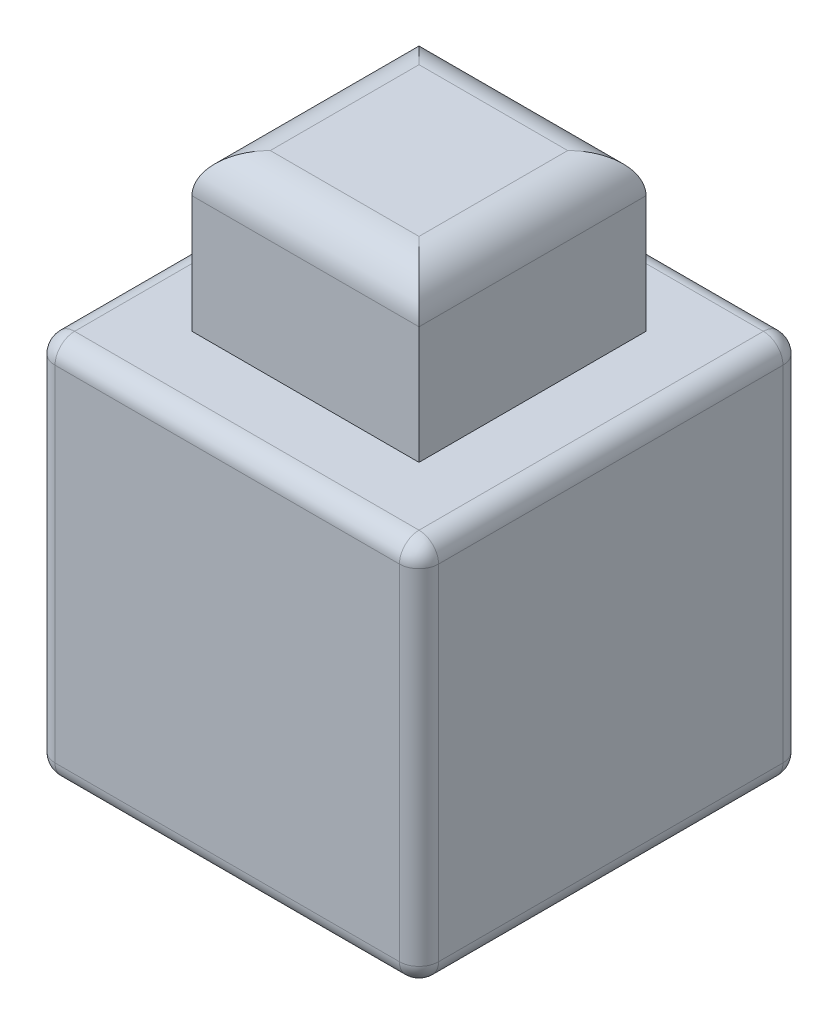
from build123d import *

# Parameters (mm, degrees)
SKETCH2_W           = 9.8
SKETCH2_H           = 9.8
BOSS_EXTRUDE1_DEPTH = 9.8
SKETCH3_W           = 5.8
SKETCH3_H           = 5.8
BOSS_EXTRUDE2_DEPTH = 4
FILLET3_R           = 1
FILLET4_R           = 0.5


with BuildPart() as part:
    # Sketch2 → Boss-Extrude1 (new body)
    with BuildSketch(Plane.XY):
        Rectangle(SKETCH2_W, SKETCH2_H)
    extrude(amount=-BOSS_EXTRUDE1_DEPTH)

    # Sketch3 → Boss-Extrude2 (add)
    with BuildSketch(Plane(origin=(0, 4.9, 0), x_dir=(1, 0, 0), z_dir=(0, 1, 0))):
        with Locations((0, 4.9)):
            Rectangle(SKETCH3_W, SKETCH3_H)
    extrude(amount=BOSS_EXTRUDE2_DEPTH)

    # Fillet3
    fillet3_edges = [part.edges().sort_by_distance(p)[0] for p in [
        (2.9, 8.9, -4.9),
        (0, 8.9, -7.8),
        (-2.9, 8.9, -4.9),
        (0, 8.9, -2),
    ]]
    fillet(fillet3_edges, radius=FILLET3_R)

    # Fillet4
    fillet4_edges = [part.edges().sort_by_distance(p)[0] for p in [
        (-4.9, 0, -9.8),
        (0, -4.9, -9.8),
        (4.9, 0, -9.8),
        (0, -4.9, 0),
        (-4.9, 0, 0),
        (0, 4.9, 0),
        (4.9, 0, 0),
        (4.9, -4.9, -4.9),
        (-4.9, -4.9, -4.9),
        (-4.9, 4.9, -4.9),
        (4.9, 4.9, -4.9),
        (0, 4.9, -9.8),
    ]]
    fillet(fillet4_edges, radius=FILLET4_R)


solid = part.part
